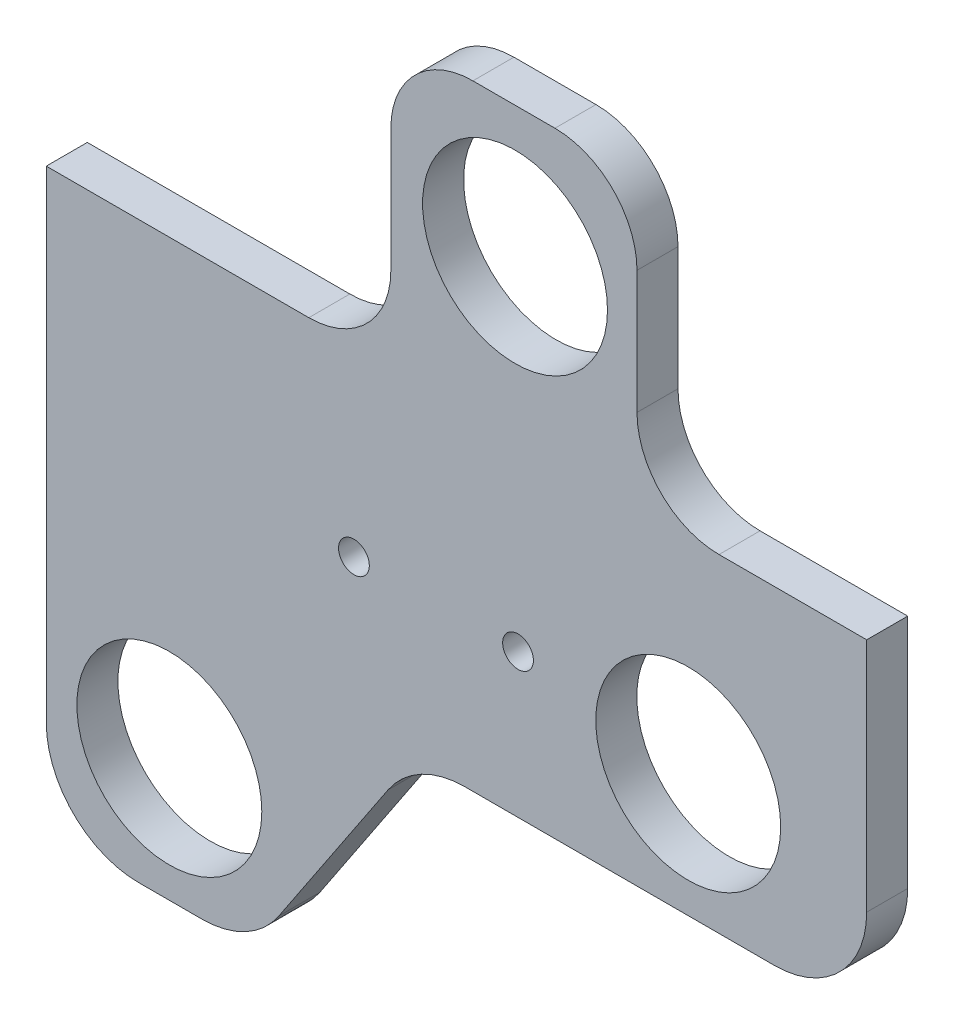
from build123d import *

# Parameters (mm, degrees)
SKETCH1_R           = 14.3129
BOSS_EXTRUDE1_DEPTH = 6.35
FILLET1_R           = 14.2875
SKETCH2_W           = 38.1
SKETCH2_H           = 44.45
BOSS_EXTRUDE2_DEPTH = 6.35
SKETCH3_R           = 14.3129
CUT_EXTRUDE1_DEPTH  = 110.433918417
SKETCH5_R           = 2.38125
CUT_EXTRUDE3_DEPTH  = 110.433918417
FILLET2_R           = 12.7


with BuildPart() as part:
    # Sketch1 → Boss-Extrude1 (new body)
    with BuildSketch(Plane.XY):
        Polygon((-6.35, -6.35), (63.5, -6.35), (63.5, 44.45), (-63.5, 44.45), (-63.5, -44.45), (-31.75, -44.45), align=None)
        with Locations((-44.45, -25.4)):
            Circle(SKETCH1_R, mode=Mode.SUBTRACT)
        with Locations((35.871852568, 12.7)):
            Circle(SKETCH1_R, mode=Mode.SUBTRACT)
    extrude(amount=BOSS_EXTRUDE1_DEPTH)

    # Fillet1
    fillet1_edges = [part.edges().sort_by_distance(p)[0] for p in [
        (-31.75, -44.45, 3.175),
        (-63.5, -44.45, 3.175),
        (63.5, -6.35, 3.175),
        (-6.35, -6.35, 3.175),
    ]]
    fillet(fillet1_edges, radius=FILLET1_R)

    # Sketch2 → Boss-Extrude2 (add)
    with BuildSketch(Plane.XY.offset(6.35)):
        with Locations((8.89, 66.675)):
            Rectangle(SKETCH2_W, SKETCH2_H)
    extrude(amount=-BOSS_EXTRUDE2_DEPTH)

    # Sketch3 → Cut-Extrude1 (cut, through all)
    with BuildSketch(Plane.XY.offset(6.35)):
        with Locations((9.062967637, 68.577618639)):
            Circle(SKETCH3_R)
    extrude(amount=-CUT_EXTRUDE1_DEPTH, mode=Mode.SUBTRACT)

    # Sketch5 → Cut-Extrude3 (cut, through all)
    with BuildSketch(Plane.XY.offset(6.35)):
        with Locations((-15.875, 15.875)):
            Circle(SKETCH5_R)
        with Locations((9.525, 15.875)):
            Circle(SKETCH5_R)
    extrude(amount=-CUT_EXTRUDE3_DEPTH, mode=Mode.SUBTRACT)

    # Fillet2
    fillet2_edges = [part.edges().sort_by_distance(p)[0] for p in [
        (-10.16, 44.45, 3.175),
        (-10.16, 88.9, 3.175),
        (27.94, 88.9, 3.175),
        (27.94, 44.45, 3.175),
    ]]
    fillet(fillet2_edges, radius=FILLET2_R)


solid = part.part
